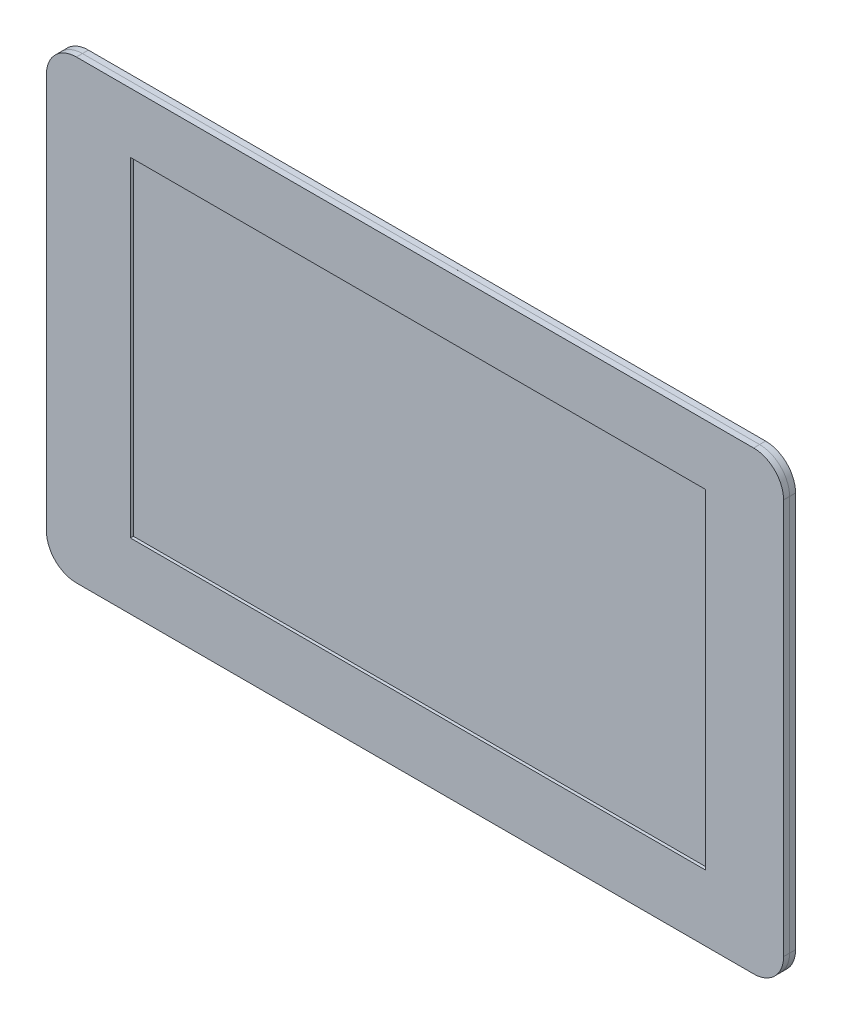
from build123d import *

# Parameters (mm, degrees)
SKETCH1_W           = 96
SKETCH1_H           = 55
BOSS_EXTRUDE1_DEPTH = 1
SKETCH2_W           = 96
SKETCH2_H           = 55
BOSS_EXTRUDE2_DEPTH = 0.5
SKETCH3_W           = 105
SKETCH3_H           = 72
BOSS_EXTRUDE3_DEPTH = 1
EXTRUDE_THIN2_DEPTH = 16
SKETCH5_W           = 3.5
SKETCH5_H           = 14
BOSS_EXTRUDE4_DEPTH = 1
SKETCH6_W           = 105
SKETCH6_H           = 67
BOSS_EXTRUDE5_DEPTH = 3.2


with BuildPart() as part:
    # Sketch1 → Boss-Extrude1 (new body)
    with BuildSketch(Plane.XY):
        with BuildLine():
            Line((-56.5, -38), (56.5, -38))
            ThreePointArc((56.5, -38), (60.035533906, -36.535533906), (61.5, -33))
            Line((61.5, -33), (61.5, 33))
            ThreePointArc((61.5, 33), (60.035533906, 36.535533906), (56.5, 38))
            Line((56.5, 38), (-56.5, 38))
            ThreePointArc((-56.5, 38), (-60.035533906, 36.535533906), (-61.5, 33))
            Line((-61.5, 33), (-61.5, -33))
            ThreePointArc((-61.5, -33), (-60.035533906, -36.535533906), (-56.5, -38))
        make_face()
        with Locations((0.5, 0.5)):
            Rectangle(SKETCH1_W, SKETCH1_H, mode=Mode.SUBTRACT)
    extrude(amount=BOSS_EXTRUDE1_DEPTH)


with BuildPart() as body_2:
    # Sketch2 → Boss-Extrude2 (new, symmetric)
    with BuildSketch(Plane(origin=(0, 0, 0), x_dir=(-1, 0, 0), z_dir=(0, 0, -1))):
        with Locations((-0.5, 0.5)):
            Rectangle(SKETCH2_W, SKETCH2_H)
    extrude(amount=BOSS_EXTRUDE2_DEPTH, both=True)


with BuildPart() as body_3:
    # Sketch3 → Boss-Extrude3 (new body)
    with BuildSketch(Plane(origin=(0, 0, 0), x_dir=(-1, 0, 0), z_dir=(0, 0, -1))):
        with BuildLine():
            Line((61.5, -33), (61.5, 33))
            ThreePointArc((61.5, 33), (60.035533906, 36.535533906), (56.5, 38))
            Line((56.5, 38), (-56.5, 38))
            ThreePointArc((-56.5, 38), (-60.035533906, 36.535533906), (-61.5, 33))
            Line((-61.5, 33), (-61.5, -33))
            ThreePointArc((-61.5, -33), (-60.035533906, -36.535533906), (-56.5, -38))
            Line((-56.5, -38), (56.5, -38))
            ThreePointArc((56.5, -38), (60.035533906, -36.535533906), (61.5, -33))
        make_face()
        Rectangle(SKETCH3_W, SKETCH3_H, mode=Mode.SUBTRACT)
    extrude(amount=BOSS_EXTRUDE3_DEPTH)


with BuildPart() as body_4:
    # Sketch4 → Extrude-Thin2 (new body)
    with BuildSketch(Plane(origin=(46.5, 0, 0), x_dir=(0, 0, -1), z_dir=(1, 0, 0))):
        with BuildLine():
            ThreePointArc((1, -35.5), (3.5, -38), (6, -35.5))
            Line((6, -35.5), (6, -17.5))
            Line((6, -17.5), (7, -17.5))
            Line((7, -17.5), (7, -35.5))
            ThreePointArc((7, -35.5), (3.5, -39), (0, -35.5))
            Line((0, -35.5), (1, -35.5))
        make_face()
    extrude(amount=-EXTRUDE_THIN2_DEPTH)

    # Sketch5 → Boss-Extrude4 (add)
    with BuildSketch(Plane(origin=(0, 0, -7), x_dir=(-1, 0, 0), z_dir=(0, 0, -1))):
        with Locations((-32.25, -10.5)):
            Rectangle(SKETCH5_W, SKETCH5_H)
    extrude(amount=-BOSS_EXTRUDE4_DEPTH)


with BuildPart() as body_5:
    # Sketch6 → Boss-Extrude5 (new body)
    with BuildSketch(Plane(origin=(0, 0, 0), x_dir=(-1, 0, 0), z_dir=(0, 0, -1))):
        with Locations((0, -2)):
            Rectangle(SKETCH6_W, SKETCH6_H)
    extrude(amount=BOSS_EXTRUDE5_DEPTH)


solid = Compound([part.part, body_2.part, body_3.part, body_4.part, body_5.part])
